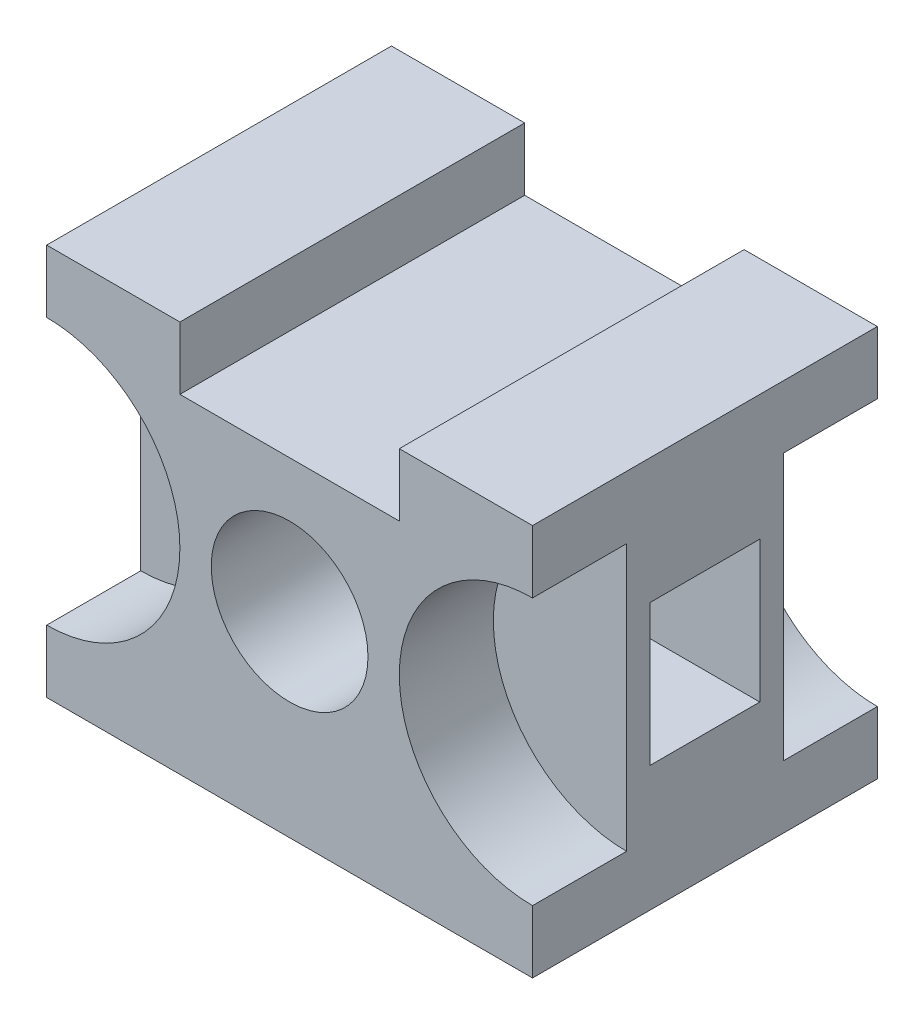
from build123d import *

# Parameters (mm, degrees)
SKETCH1_W           = 62
SKETCH1_H           = 50
BOSS_EXTRUDE1_DEPTH = 44
SKETCH2_R           = 10
CUT_EXTRUDE1_DEPTH  = 56
CUT_EXTRUDE2_DEPTH  = 12
CUT_EXTRUDE3_START  = -12
CUT_EXTRUDE3_DEPTH  = 12
SKETCH5_W           = 28
SKETCH5_H           = 8
CUT_EXTRUDE4_DEPTH  = 71
SKETCH6_W           = 14
SKETCH6_H           = 18
CUT_EXTRUDE5_DEPTH  = 71


with BuildPart() as part:
    # Sketch1 → Boss-Extrude1 (new body)
    with BuildSketch(Plane.XY):
        with Locations((31, 25)):
            Rectangle(SKETCH1_W, SKETCH1_H)
    extrude(amount=-BOSS_EXTRUDE1_DEPTH)

    # Sketch2 → Cut-Extrude1 (cut)
    with BuildSketch(Plane.XY):
        with Locations((31, 25)):
            Circle(SKETCH2_R)
    extrude(amount=-CUT_EXTRUDE1_DEPTH, mode=Mode.SUBTRACT)

    # Sketch3 → Cut-Extrude2 (cut)
    with BuildSketch(Plane.XY):
        with BuildLine():
            ThreePointArc((17, 25), (12.02081528, 37.02081528), (0, 42))
            Line((0, 42), (0, 8))
            ThreePointArc((0, 8), (12.02081528, 12.97918472), (17, 25))
        make_face()
        with BuildLine():
            Line((0, 8), (0, 42))
            ThreePointArc((0, 42), (-17, 25), (0, 8))
        make_face()
        with BuildLine():
            ThreePointArc((79, 25), (74.02081528, 37.02081528), (62, 42))
            Line((62, 42), (62, 8))
            ThreePointArc((62, 8), (74.02081528, 12.97918472), (79, 25))
        make_face()
        with BuildLine():
            Line((62, 8), (62, 42))
            ThreePointArc((62, 42), (45, 25), (62, 8))
        make_face()
    extrude(amount=-CUT_EXTRUDE2_DEPTH, mode=Mode.SUBTRACT)

    # Sketch4 → Cut-Extrude3 (cut)
    with BuildSketch(Plane(origin=(0, 0, -44), x_dir=(-1, 0, 0), z_dir=(0, 0, -1)).offset(CUT_EXTRUDE3_START)):
        with BuildLine():
            ThreePointArc((-62, 42), (-79, 25), (-62, 8))
            Line((-62, 8), (-62, 42))
        make_face()
        with BuildLine():
            Line((-62, 42), (-62, 8))
            ThreePointArc((-62, 8), (-49.97918472, 12.97918472), (-45, 25))
            ThreePointArc((-45, 25), (-49.97918472, 37.02081528), (-62, 42))
        make_face()
        with BuildLine():
            ThreePointArc((0, 42), (-17, 25), (0, 8))
            Line((0, 8), (0, 42))
        make_face()
        with BuildLine():
            Line((0, 42), (0, 8))
            ThreePointArc((0, 8), (12.02081528, 12.97918472), (17, 25))
            ThreePointArc((17, 25), (12.02081528, 37.02081528), (0, 42))
        make_face()
    extrude(amount=CUT_EXTRUDE3_DEPTH, mode=Mode.SUBTRACT)

    # Sketch5 → Cut-Extrude4 (cut)
    with BuildSketch(Plane.XY):
        with Locations((31, 46)):
            Rectangle(SKETCH5_W, SKETCH5_H)
    extrude(amount=-CUT_EXTRUDE4_DEPTH, mode=Mode.SUBTRACT)

    # Sketch6 → Cut-Extrude5 (cut)
    with BuildSketch(Plane.ZY):
        with Locations((-22, 25)):
            Rectangle(SKETCH6_W, SKETCH6_H)
    extrude(amount=-CUT_EXTRUDE5_DEPTH, mode=Mode.SUBTRACT)


solid = part.part
